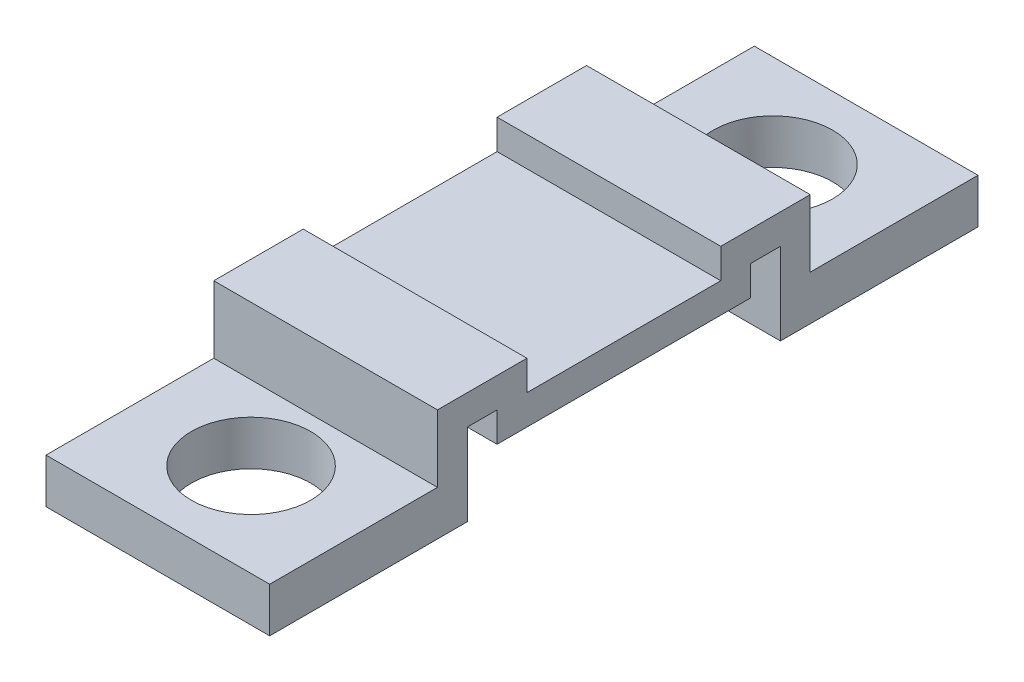
from build123d import *

# Parameters (mm, degrees)
BOSS_EXTRUDE4_DEPTH = 3
CUT_EXTRUDE1_REACH  = 12.124
SKETCH5_R           = 1.6


with BuildPart() as part:
    # Sketch4 → Boss-Extrude4 (new, symmetric)
    with BuildSketch(Plane(origin=(0, 0, 0), x_dir=(0, 0, -1), z_dir=(1, 0, 0))):
        Polygon((-5, -1), (-5, 0.8), (-2.6, 0.8), (-2.6, 0), (2.6, 0), (2.6, 0.8), (5, 0.8), (5, -1), (9.5, -1), (9.5, -2.2), (4.2, -2.2), (4.2, 0), (3.4, 0), (3.4, -0.8), (-3.4, -0.8), (-3.4, 0), (-4.2, 0), (-4.2, -2.2), (-9.5, -2.2), (-9.5, -1), align=None)
    extrude(amount=BOSS_EXTRUDE4_DEPTH, both=True)

    # Sketch5 → Cut-Extrude1 (cut, up to next)
    with BuildSketch(Plane(origin=(0, -1, 0), x_dir=(1, 0, 0), z_dir=(0, 1, 0)), mode=Mode.PRIVATE) as cut_extrude1_sk1:
        with Locations(Location((0, -7, 0), (0, 0, 270))):
            Circle(SKETCH5_R)
    cut_extrude1_tool1 = extrude(cut_extrude1_sk1.sketch, amount=-CUT_EXTRUDE1_REACH, mode=Mode.PRIVATE) & part.part
    # Sketch5 → Cut-Extrude1 (cut, up to next)
    with BuildSketch(Plane(origin=(0, -1, 0), x_dir=(1, 0, 0), z_dir=(0, 1, 0)), mode=Mode.PRIVATE) as cut_extrude1_sk2:
        with Locations(Location((0, 7, 0), (0, 0, 270))):
            Circle(SKETCH5_R)
    cut_extrude1_tool2 = extrude(cut_extrude1_sk2.sketch, amount=-CUT_EXTRUDE1_REACH, mode=Mode.PRIVATE) & part.part
    add(cut_extrude1_tool1.solids().sort_by_distance((0, -1, 7))[0], mode=Mode.SUBTRACT)
    add(cut_extrude1_tool2.solids().sort_by_distance((0, -1, -7))[0], mode=Mode.SUBTRACT)


solid = part.part
